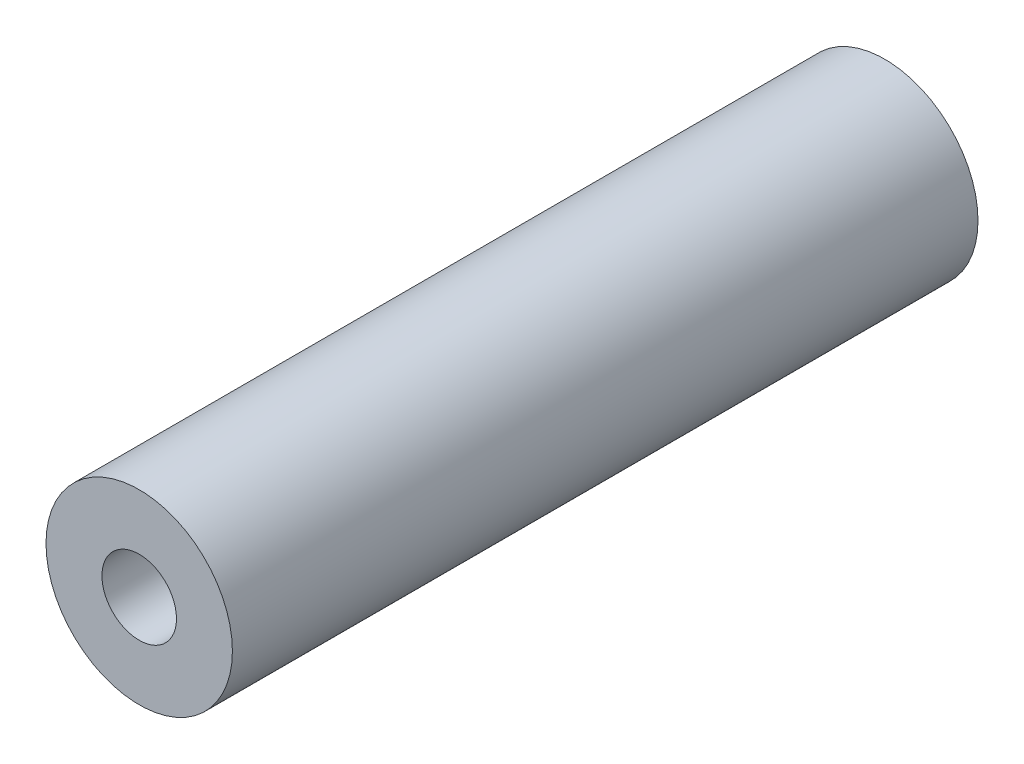
from build123d import *

# Parameters (mm, degrees)
SKETCH_1_R      = 2.5
SKETCH_1_R_2    = 1
EXTRUDE_1_DEPTH = 20


with BuildPart() as part:
    # 草图1 → 凸台-拉伸1 (new body)
    with BuildSketch(Plane.XY):
        Circle(SKETCH_1_R)
        Circle(SKETCH_1_R_2, mode=Mode.SUBTRACT)
    extrude(amount=EXTRUDE_1_DEPTH)


solid = part.part
